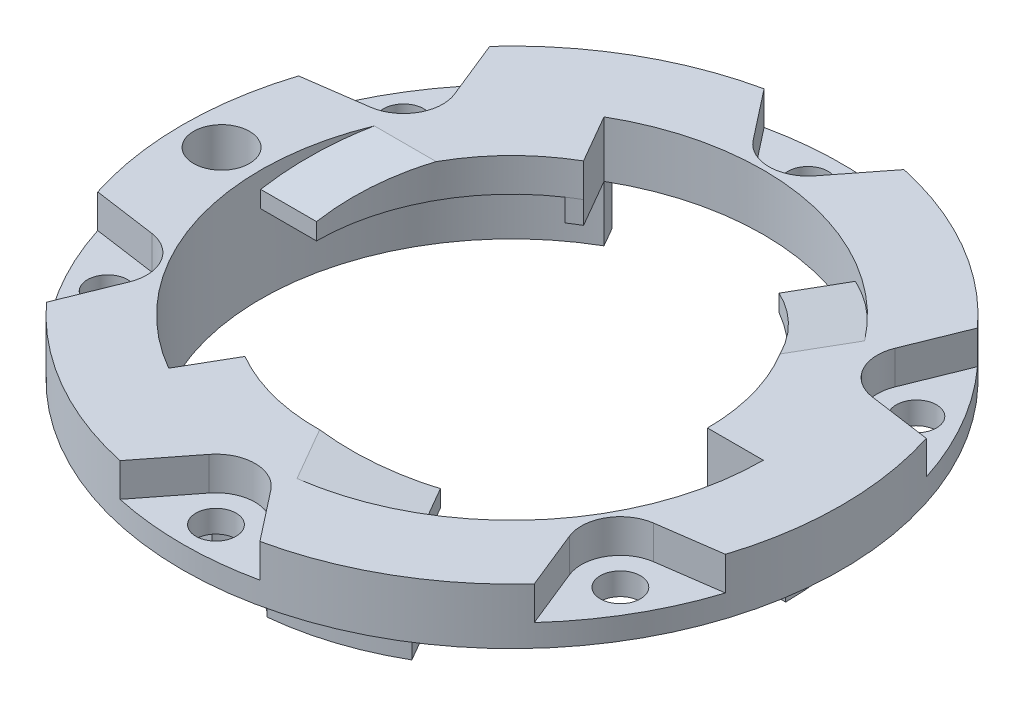
from build123d import *
from build123d.topology import SkipClean

# Parameters (mm, degrees)
SKETCH2_R             = 24.5
SKETCH2_R_2           = 22.5
BOSS_EXTRUDE1_DEPTH   = 10
BOSS_EXTRUDE2_START   = -5
SKETCH3_R             = 29.5
SKETCH3_R_2           = 24.5
BOSS_EXTRUDE2_DEPTH   = 2
CUT_EXTRUDE1_REACH    = 44.302
SKETCH5_R             = 1.8
SKETCH6_R             = 3.5
CUT_EXTRUDE2_DEPTH    = 3
SKETCH7_R             = 3.25
CUT_EXTRUDE3_DEPTH    = 5
BOSS_EXTRUDE3_DEPTH   = 3
BOSS_EXTRUDE3_2_DEPTH = 3
BOSS_EXTRUDE3_3_DEPTH = 3
BOSS_EXTRUDE4_DEPTH   = 2
CHAMFER1_SIZE         = 1.5
CHAMFER1_SIZE2        = 8.506922729
CHAMFER2_SIZE         = 1.5
CHAMFER2_SIZE2        = 8.506922729
CHAMFER3_SIZE         = 1.5
CHAMFER3_SIZE2        = 8.506922729
CUT_EXTRUDE4_DEPTH    = 5
BOSS_EXTRUDE5_START   = -3
BOSS_EXTRUDE5_DEPTH   = 3
SKETCH14_R            = 2.5
CUT_EXTRUDE5_DEPTH    = 43.901048938


with BuildPart() as part:
    # Sketch2 → Boss-Extrude1 (new body)
    with BuildSketch(Plane(origin=(0, 0, 0), x_dir=(1, 0, 0), z_dir=(0, 1, 0))):
        with Locations(Location((0, 0, 0), (0, 0, 270))):
            Circle(SKETCH2_R)
        with Locations(Location((0, 0, 0), (0, 0, 270))):
            Circle(SKETCH2_R_2, mode=Mode.SUBTRACT)
    extrude(amount=BOSS_EXTRUDE1_DEPTH)

    # Sketch3 → Boss-Extrude2 (add)
    with BuildSketch(Plane(origin=(0, 10, 0), x_dir=(1, 0, 0), z_dir=(0, 1, 0)).offset(BOSS_EXTRUDE2_START)):
        with Locations(Location((0, 0, 0), (0, 0, 270))):
            Circle(SKETCH3_R)
        with Locations(Location((0, 0, 0), (0, 0, 270))):
            Circle(SKETCH3_R_2, mode=Mode.SUBTRACT)
    extrude(amount=BOSS_EXTRUDE2_DEPTH)

    # Sketch5 → Cut-Extrude1 (cut, up to next)
    with BuildSketch(Plane(origin=(0, 7, 0), x_dir=(1, 0, 0), z_dir=(0, 1, 0)), mode=Mode.PRIVATE) as cut_extrude1_sk1:
        with Locations(Location((0, 26.5, 0), (0, 0, 270))):
            Circle(SKETCH5_R)
    cut_extrude1_tool1 = extrude(cut_extrude1_sk1.sketch, amount=-CUT_EXTRUDE1_REACH, mode=Mode.PRIVATE) & part.part
    # Sketch5 → Cut-Extrude1 (cut, up to next)
    with BuildSketch(Plane(origin=(0, 7, 0), x_dir=(1, 0, 0), z_dir=(0, 1, 0)), mode=Mode.PRIVATE) as cut_extrude1_sk2:
        with Locations(Location((22.9496732, 13.25, 0), (0, 0, 270))):
            Circle(SKETCH5_R)
    cut_extrude1_tool2 = extrude(cut_extrude1_sk2.sketch, amount=-CUT_EXTRUDE1_REACH, mode=Mode.PRIVATE) & part.part
    # Sketch5 → Cut-Extrude1 (cut, up to next)
    with BuildSketch(Plane(origin=(0, 7, 0), x_dir=(1, 0, 0), z_dir=(0, 1, 0)), mode=Mode.PRIVATE) as cut_extrude1_sk3:
        with Locations(Location((22.9496732, -13.25, 0), (0, 0, 270))):
            Circle(SKETCH5_R)
    cut_extrude1_tool3 = extrude(cut_extrude1_sk3.sketch, amount=-CUT_EXTRUDE1_REACH, mode=Mode.PRIVATE) & part.part
    # Sketch5 → Cut-Extrude1 (cut, up to next)
    with BuildSketch(Plane(origin=(0, 7, 0), x_dir=(1, 0, 0), z_dir=(0, 1, 0)), mode=Mode.PRIVATE) as cut_extrude1_sk4:
        with Locations(Location((0, -26.5, 0), (0, 0, 270))):
            Circle(SKETCH5_R)
    cut_extrude1_tool4 = extrude(cut_extrude1_sk4.sketch, amount=-CUT_EXTRUDE1_REACH, mode=Mode.PRIVATE) & part.part
    # Sketch5 → Cut-Extrude1 (cut, up to next)
    with BuildSketch(Plane(origin=(0, 7, 0), x_dir=(1, 0, 0), z_dir=(0, 1, 0)), mode=Mode.PRIVATE) as cut_extrude1_sk5:
        with Locations(Location((-22.9496732, -13.25, 0), (0, 0, 270))):
            Circle(SKETCH5_R)
    cut_extrude1_tool5 = extrude(cut_extrude1_sk5.sketch, amount=-CUT_EXTRUDE1_REACH, mode=Mode.PRIVATE) & part.part
    # Sketch5 → Cut-Extrude1 (cut, up to next)
    with BuildSketch(Plane(origin=(0, 7, 0), x_dir=(1, 0, 0), z_dir=(0, 1, 0)), mode=Mode.PRIVATE) as cut_extrude1_sk6:
        with Locations(Location((-22.9496732, 13.25, 0), (0, 0, 270))):
            Circle(SKETCH5_R)
    cut_extrude1_tool6 = extrude(cut_extrude1_sk6.sketch, amount=-CUT_EXTRUDE1_REACH, mode=Mode.PRIVATE) & part.part
    add(cut_extrude1_tool1.solids().sort_by_distance((0, 7, -26.5))[0], mode=Mode.SUBTRACT)
    add(cut_extrude1_tool2.solids().sort_by_distance((22.949673, 7, -13.25))[0], mode=Mode.SUBTRACT)
    add(cut_extrude1_tool3.solids().sort_by_distance((22.949673, 7, 13.25))[0], mode=Mode.SUBTRACT)
    add(cut_extrude1_tool4.solids().sort_by_distance((0, 7, 26.5))[0], mode=Mode.SUBTRACT)
    add(cut_extrude1_tool5.solids().sort_by_distance((-22.949673, 7, 13.25))[0], mode=Mode.SUBTRACT)
    add(cut_extrude1_tool6.solids().sort_by_distance((-22.949673, 7, -13.25))[0], mode=Mode.SUBTRACT)

    # Sketch6 → Cut-Extrude2 (cut)
    with BuildSketch(Plane(origin=(0, 10, 0), x_dir=(1, 0, 0), z_dir=(0, 1, 0))):
        with Locations((0, 26.5)):
            Circle(SKETCH6_R)
        with Locations((22.9496732, 13.25)):
            Circle(SKETCH6_R)
        with Locations((22.9496732, -13.25)):
            Circle(SKETCH6_R)
        with Locations((0, -26.5)):
            Circle(SKETCH6_R)
        with Locations((-22.9496732, -13.25)):
            Circle(SKETCH6_R)
        with Locations((-22.9496732, 13.25)):
            Circle(SKETCH6_R)
    extrude(amount=-CUT_EXTRUDE2_DEPTH, mode=Mode.SUBTRACT)

    # Sketch7 → Cut-Extrude3 (cut)
    with BuildSketch(Plane.XZ):
        with Locations((0, 26.5)):
            Circle(SKETCH7_R)
        with Locations((22.9496732, 13.25)):
            Circle(SKETCH7_R)
        with Locations((22.9496732, -13.25)):
            Circle(SKETCH7_R)
        with Locations((0, -26.5)):
            Circle(SKETCH7_R)
        with Locations((-22.9496732, -13.25)):
            Circle(SKETCH7_R)
        with Locations((-22.9496732, 13.25)):
            Circle(SKETCH7_R)
    extrude(amount=-CUT_EXTRUDE3_DEPTH, mode=Mode.SUBTRACT)



with BuildPart() as body_2:
    # Sketch8 → Boss-Extrude3 (new body)
    with BuildSketch(Plane(origin=(0, 10, 0), x_dir=(1, 0, 0), z_dir=(0, 1, 0))):
        with BuildLine():
            Line((-8.75, 15.155444566), (-11.25, 19.485571585))
            ThreePointArc((-11.25, 19.485571585), (-19.485571585, 11.25), (-22.5, 0))
            Line((-22.5, 0), (-17.5, 0))
            ThreePointArc((-17.5, 0), (-15.155444566, 8.75), (-8.75, 15.155444566))
        make_face()
    extrude(amount=-BOSS_EXTRUDE3_DEPTH)


with BuildPart() as body_3:
    # Sketch8 → Boss-Extrude3 2 (new body)
    with BuildSketch(Plane(origin=(0, 10, 0), x_dir=(1, 0, 0), z_dir=(0, 1, 0))):
        with BuildLine():
            Line((17.5, 0), (22.5, 0))
            ThreePointArc((22.5, 0), (19.485571585, 11.25), (11.25, 19.485571585))
            Line((11.25, 19.485571585), (8.75, 15.155444566))
            ThreePointArc((8.75, 15.155444566), (15.155444566, 8.75), (17.5, 0))
        make_face()
    extrude(amount=-BOSS_EXTRUDE3_2_DEPTH)

    # Chamfer3
    chamfer3_edges = [body_3.edges().sort_by_distance(p)[0] for p in [
        (10, 10, -17.320508076),
    ]]
    chamfer3_side = [body_3.faces().sort_by_distance(p)[0] for p in [
        (10, 8.5, -17.320508076),
    ]]
    chamfer(chamfer3_edges, length=CHAMFER3_SIZE, length2=CHAMFER3_SIZE2, reference=chamfer3_side[0])



with BuildPart() as body_4:
    # Sketch8 → Boss-Extrude3 3 (new body)
    with BuildSketch(Plane(origin=(0, 10, 0), x_dir=(1, 0, 0), z_dir=(0, 1, 0))):
        with BuildLine():
            Line((-8.75, -15.155444566), (-11.25, -19.485571585))
            ThreePointArc((-11.25, -19.485571585), (0, -22.5), (11.25, -19.485571585))
            Line((11.25, -19.485571585), (8.75, -15.155444566))
            ThreePointArc((8.75, -15.155444566), (0, -17.5), (-8.75, -15.155444566))
        make_face()
    extrude(amount=-BOSS_EXTRUDE3_3_DEPTH)

    # Chamfer2
    chamfer2_edges = [body_4.edges().sort_by_distance(p)[0] for p in [
        (10, 10, 17.320508076),
    ]]
    chamfer2_side = [body_4.faces().sort_by_distance(p)[0] for p in [
        (10, 8.5, 17.320508076),
    ]]
    chamfer(chamfer2_edges, length=CHAMFER2_SIZE, length2=CHAMFER2_SIZE2, reference=chamfer2_side[0])


with BuildPart() as part_1:
    add(part.part)

    add(body_2.part)  # Boss-Extrude4 merges body 2
    # Sketch9 → Boss-Extrude4 (add)
    with BuildSketch(Plane.XZ.offset(-7)):
        with BuildLine():
            Line((-8.75, -15.155444566), (-11.25, -19.485571585))
            ThreePointArc((-11.25, -19.485571585), (-11.923183918, -19.081081845), (-12.581841272, -18.653344746))
            Line((-12.581841272, -18.653344746), (-9.785876755, -14.508156883))
            ThreePointArc((-9.785876755, -14.508156883), (-9.273587596, -14.840841364), (-8.75, -15.155444566))
        make_face()
        with BuildLine():
            Line((-8.75, 15.155444566), (-11.25, 19.485571585))
            ThreePointArc((-11.25, 19.485571585), (-10.563109651, 19.866321089), (-9.863349779, 20.222866541))
            Line((-9.863349779, 20.222866541), (-7.671494045, 15.728896309))
            ThreePointArc((-7.671494045, 15.728896309), (-8.215751837, 15.451583125), (-8.75, 15.155444566))
        make_face()
        with BuildLine():
            Line((17.5, 0), (22.5, 0))
            ThreePointArc((22.5, 0), (22.486293568, -0.785239244), (22.445191051, -1.569521795))
            Line((22.445191051, -1.569521795), (17.4573708, -1.220739427))
            ThreePointArc((17.4573708, -1.220739427), (17.489339433, -0.610741761), (17.5, 0))
        make_face()
    extrude(amount=BOSS_EXTRUDE4_DEPTH)

    # Chamfer1
    chamfer1_edges = [part_1.edges().sort_by_distance(p)[0] for p in [
        (-20, 10, 0),
    ]]
    chamfer1_side = [part_1.faces().sort_by_distance(p)[0] for p in [
        (-20, 8.5, 0),
    ]]
    chamfer(chamfer1_edges, length=CHAMFER1_SIZE, length2=CHAMFER1_SIZE2, reference=chamfer1_side[0])

    # Sketch12 → Cut-Extrude4 (cut)
    with BuildSketch(Plane(origin=(0, 0, 0), x_dir=(-1, 0, 0), z_dir=(0, -1, 0))):
        with BuildLine():
            Line((-24.5, 0), (-22.5, 0))
            ThreePointArc((-22.5, 0), (-19.485571585, -11.25), (-11.25, -19.485571585))
            Line((-11.25, -19.485571585), (-12.25, -21.217622393))
            ThreePointArc((-12.25, -21.217622393), (-21.217622393, -12.25), (-24.5, 0))
        make_face()
        with BuildLine():
            Line((12.25, 21.217622393), (11.25, 19.485571585))
            ThreePointArc((11.25, 19.485571585), (0, 22.5), (-11.25, 19.485571585))
            Line((-11.25, 19.485571585), (-12.25, 21.217622393))
            ThreePointArc((-12.25, 21.217622393), (0, 24.5), (12.25, 21.217622393))
        make_face()
    extrude(amount=-CUT_EXTRUDE4_DEPTH, mode=Mode.SUBTRACT)


with BuildPart() as body_3_1:
    with SkipClean():  # the faces are left unmerged after this step: merging them gives an invalid solid
        add(body_3.part)

        add(part_1.part)  # Boss-Extrude5 merges part

        add(body_4.part)  # Boss-Extrude5 merges body 4
        # Sketch13 → Boss-Extrude5 (add)
        with BuildSketch(Plane(origin=(0, 10, 0), x_dir=(1, 0, 0), z_dir=(0, 1, 0)).offset(BOSS_EXTRUDE5_START)):
            with BuildLine():
                Line((-19.704128014, 14.560128407), (-21.834307178, 19.837162853))
                ThreePointArc((-21.834307178, 19.837162853), (-14.75, 25.547749412), (-6.262333381, 28.827646117))
                Line((-6.262333381, 28.827646117), (-2.757377076, 24.344339623))
                ThreePointArc((-2.757377076, 24.344339623), (-12.25, 21.217622393), (-19.704128014, 14.560128407))
            make_face()
            with BuildLine():
                Line((2.757377076, 24.344339623), (6.262333381, 28.827646117))
                ThreePointArc((6.262333381, 28.827646117), (14.75, 25.547749412), (21.834307178, 19.837162853))
                Line((21.834307178, 19.837162853), (19.704128014, 14.560128407))
                ThreePointArc((19.704128014, 14.560128407), (12.25, 21.217622393), (2.757377076, 24.344339623))
            make_face()
            with BuildLine():
                Line((22.461505089, 9.784211216), (28.096640559, 8.990483263))
                ThreePointArc((28.096640559, 8.990483263), (29.5, 0), (28.096640559, -8.990483263))
                Line((28.096640559, -8.990483263), (22.461505089, -9.784211216))
                ThreePointArc((22.461505089, -9.784211216), (24.5, 0), (22.461505089, 9.784211216))
            make_face()
            with BuildLine():
                Line((19.704128014, -14.560128407), (21.834307178, -19.837162853))
                ThreePointArc((21.834307178, -19.837162853), (14.75, -25.547749412), (6.262333381, -28.827646117))
                Line((6.262333381, -28.827646117), (2.757377076, -24.344339623))
                ThreePointArc((2.757377076, -24.344339623), (12.25, -21.217622393), (19.704128014, -14.560128407))
            make_face()
            with BuildLine():
                Line((-2.757377076, -24.344339623), (-6.262333381, -28.827646117))
                ThreePointArc((-6.262333381, -28.827646117), (-14.75, -25.547749412), (-21.834307178, -19.837162853))
                Line((-21.834307178, -19.837162853), (-19.704128014, -14.560128407))
                ThreePointArc((-19.704128014, -14.560128407), (-12.25, -21.217622393), (-2.757377076, -24.344339623))
            make_face()
            with BuildLine():
                Line((-22.461505089, -9.784211216), (-28.096640559, -8.990483263))
                ThreePointArc((-28.096640559, -8.990483263), (-29.5, 0), (-28.096640559, 8.990483263))
                Line((-28.096640559, 8.990483263), (-22.461505089, 9.784211216))
                ThreePointArc((-22.461505089, 9.784211216), (-24.5, 0), (-22.461505089, -9.784211216))
            make_face()
        extrude(amount=BOSS_EXTRUDE5_DEPTH)

    # Sketch14 → Cut-Extrude5 (cut, through all)
    with SkipClean():  # the faces are left unmerged after this step: merging them gives an invalid solid
        with BuildSketch(Plane(origin=(0, 10, 0), x_dir=(1, 0, 0), z_dir=(0, 1, 0))):
            with Locations(Location((-26, 0, 0), (0, 0, 270))):
                Circle(SKETCH14_R)
        extrude(amount=-CUT_EXTRUDE5_DEPTH, mode=Mode.SUBTRACT)


solid = body_3_1.part
